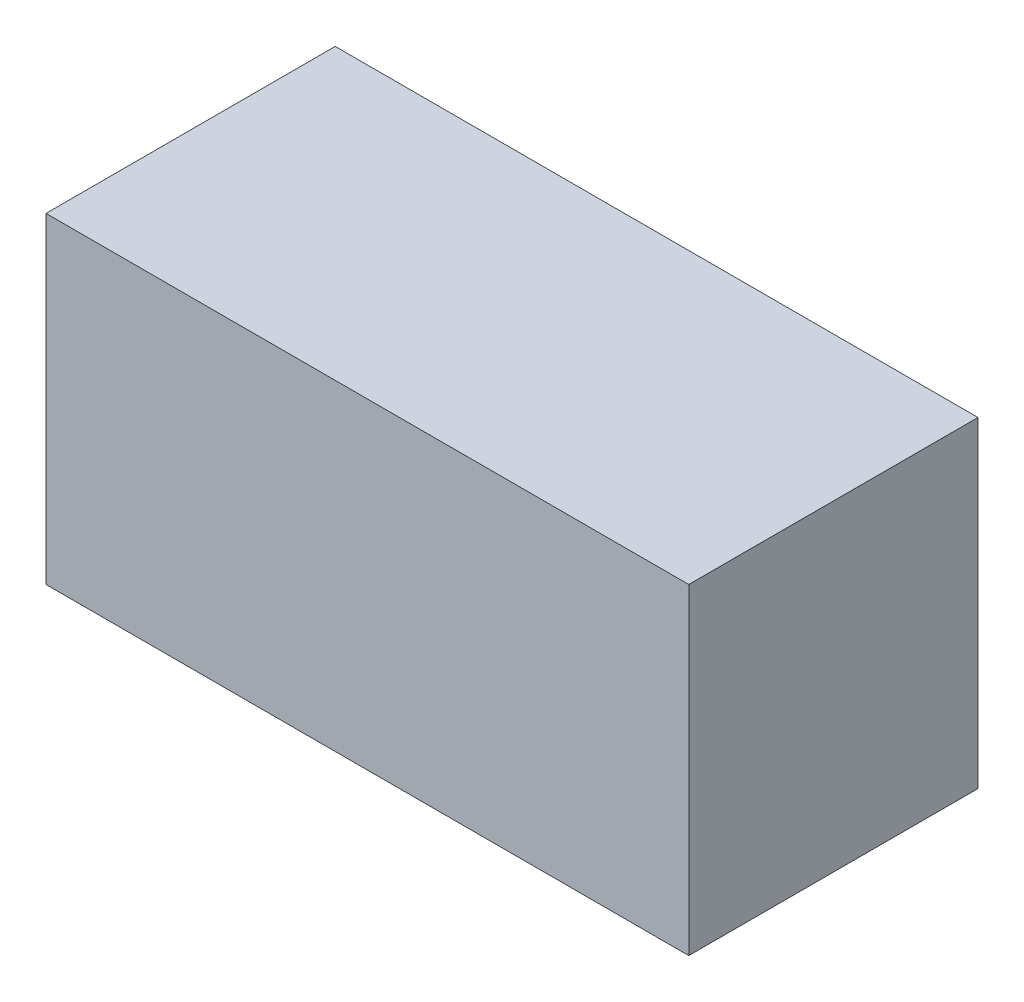
from build123d import *

# Parameters (mm, degrees)
SKETCH_1_W              = 2
SKETCH_1_H              = 1
COMPONENT_OUTLINE_DEPTH = 0.9


with BuildPart() as part:
    # 草图1 → Component_Outline (new body)
    with BuildSketch(Plane.XY):
        Rectangle(SKETCH_1_W, SKETCH_1_H)
    extrude(amount=COMPONENT_OUTLINE_DEPTH)


solid = part.part
